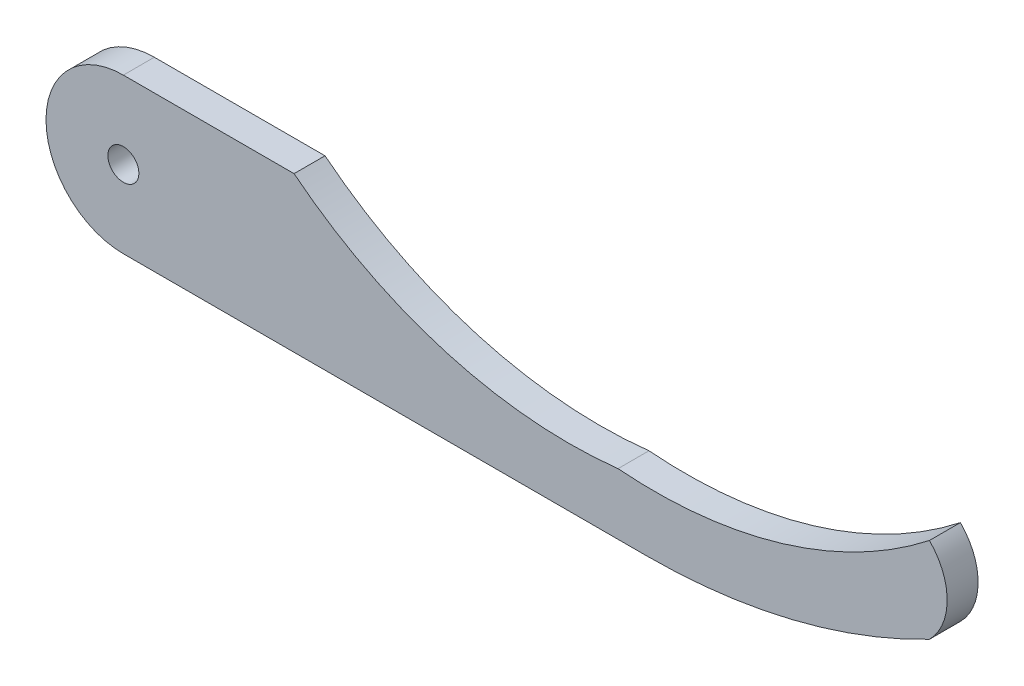
from build123d import *

# Parameters (mm, degrees)
Y_KSEKLIK_EKSTR_ZYON1_DEPTH = 3
IZIM2_R                     = 1.5
KES_EKSTR_ZYON1_DEPTH       = 12.5


with BuildPart() as part:
    # Çizim1 → Yükseklik-Ekstrüzyon1 (new body)
    with BuildSketch(Plane.XY):
        with BuildLine():
            Line((-50, 7.5), (-33.453317398, 7.5))
            ThreePointArc((-33.453317398, 7.5), (-18.650063238, -0.147459849), (-2.048249465, -1.561586909))
            ThreePointArc((-2.048249465, -1.561586909), (13.901303084, 0.11670329), (28.138290623, 7.5))
            ThreePointArc((28.138290623, 7.5), (29.856514488, 3.351840642), (28.138290623, -0.796318716))
            ThreePointArc((28.138290623, -0.796318716), (14.826618758, -5.799776605), (0.707679736, -7.5))
            Line((0.707679736, -7.5), (-50, -7.5))
            ThreePointArc((-50, -7.5), (-57.5, 0), (-50, 7.5))
        make_face()
    extrude(amount=Y_KSEKLIK_EKSTR_ZYON1_DEPTH)

    # Çizim2 → Kes-Ekstrüzyon1 (cut)
    with BuildSketch(Plane.XY.offset(3)):
        with Locations((-50, 0)):
            Circle(IZIM2_R)
    extrude(amount=-KES_EKSTR_ZYON1_DEPTH, mode=Mode.SUBTRACT)


solid = part.part
